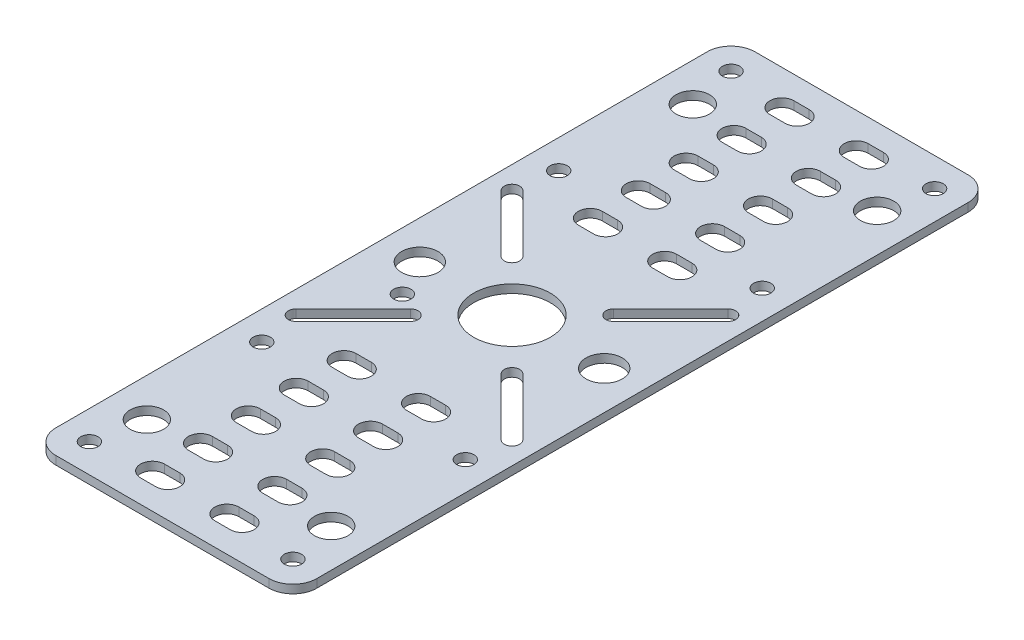
from build123d import *

# Parameters (mm, degrees)
SKETCH1_W            = 54.5
SKETCH1_H            = 146
BOSS_EXTRUDE1_DEPTH  = 1.75
SKETCH2_R            = 3.5
SKETCH2_R_2          = 3.795961701
SKETCH2_R_3          = 8
CUT_EXTRUDE1_DEPTH   = 78.939880677
M3_CLEARANCE_HOLE1_D = 3.6
FILLET1_R            = 5


with BuildPart() as part:
    # Sketch1 → Boss-Extrude1 (new body)
    with BuildSketch(Plane(origin=(0, 0, 0), x_dir=(1, 0, 0), z_dir=(0, 1, 0))):
        Rectangle(SKETCH1_W, SKETCH1_H)
    extrude(amount=BOSS_EXTRUDE1_DEPTH)

    # Sketch2 → Cut-Extrude1 (cut, through all)
    with BuildSketch(Plane(origin=(0, 1.75, 0), x_dir=(1, 0, 0), z_dir=(0, 1, 0))):
        with Locations(Location((-19.25, 57, 0), (0, 0, 270))):
            Circle(SKETCH2_R)
        with Locations(Location((-19.25, 0, 0), (0, 0, 270))):
            Circle(SKETCH2_R_2)
        with Locations(Location((-19.25, -57, 0), (0, 0, 90))):
            Circle(SKETCH2_R)
        with Locations(Location((19.25, -57, 0), (0, 0, 270))):
            Circle(SKETCH2_R)
        with Locations(Location((19.25, 0, 0), (0, 0, 90))):
            Circle(SKETCH2_R_2)
        with Locations(Location((19.25, 57, 0), (0, 0, 90))):
            Circle(SKETCH2_R)
        with Locations(Location((0, 0, 0), (0, 0, 270))):
            Circle(SKETCH2_R_3)
        with BuildLine():
            Line((-11.737972568, 9.475230868), (-23.68137085, 21.41862915))
            ThreePointArc((-23.68137085, 21.41862915), (-23.68137085, 23.68137085), (-21.41862915, 23.68137085))
            Line((-21.41862915, 23.68137085), (-9.475230868, 11.737972568))
            ThreePointArc((-9.475230868, 11.737972568), (-9.475230868, 9.475230868), (-11.737972568, 9.475230868))
        make_face()
        with BuildLine():
            Line((11.737972568, 9.475230868), (23.68137085, 21.41862915))
            ThreePointArc((23.68137085, 21.41862915), (23.68137085, 23.68137085), (21.41862915, 23.68137085))
            Line((21.41862915, 23.68137085), (9.475230868, 11.737972568))
            ThreePointArc((9.475230868, 11.737972568), (9.475230868, 9.475230868), (11.737972568, 9.475230868))
        make_face()
        with BuildLine():
            Line((-11.737972568, -9.475230868), (-23.68137085, -21.41862915))
            ThreePointArc((-23.68137085, -21.41862915), (-23.68137085, -23.68137085), (-21.41862915, -23.68137085))
            Line((-21.41862915, -23.68137085), (-9.475230868, -11.737972568))
            ThreePointArc((-9.475230868, -11.737972568), (-9.475230868, -9.475230868), (-11.737972568, -9.475230868))
        make_face()
        with BuildLine():
            Line((11.737972568, -9.475230868), (23.68137085, -21.41862915))
            ThreePointArc((23.68137085, -21.41862915), (23.68137085, -23.68137085), (21.41862915, -23.68137085))
            Line((21.41862915, -23.68137085), (9.475230868, -11.737972568))
            ThreePointArc((9.475230868, -11.737972568), (9.475230868, -9.475230868), (11.737972568, -9.475230868))
        make_face()
        with BuildLine():
            Line((-9.357792216, 68.20993346), (-6.161205405, 68.20993346))
            ThreePointArc((-6.161205405, 68.20993346), (-3.661205405, 65.70993346), (-6.161205405, 63.20993346))
            Line((-6.161205405, 63.20993346), (-9.357792216, 63.20993346))
            ThreePointArc((-9.357792216, 63.20993346), (-11.857792216, 65.70993346), (-9.357792216, 68.20993346))
        make_face()
        with BuildLine():
            Line((-9.357792216, 58.20993346), (-6.161205405, 58.20993346))
            ThreePointArc((-6.161205405, 58.20993346), (-3.661205405, 55.70993346), (-6.161205405, 53.20993346))
            Line((-6.161205405, 53.20993346), (-9.357792216, 53.20993346))
            ThreePointArc((-9.357792216, 53.20993346), (-11.857792216, 55.70993346), (-9.357792216, 58.20993346))
        make_face()
        with BuildLine():
            Line((9.357792216, 58.20993346), (6.161205405, 58.20993346))
            ThreePointArc((6.161205405, 58.20993346), (3.661205405, 55.70993346), (6.161205405, 53.20993346))
            Line((6.161205405, 53.20993346), (9.357792216, 53.20993346))
            ThreePointArc((9.357792216, 53.20993346), (11.857792216, 55.70993346), (9.357792216, 58.20993346))
        make_face()
        with BuildLine():
            Line((-9.357792216, 48.20993346), (-6.161205405, 48.20993346))
            ThreePointArc((-6.161205405, 48.20993346), (-3.661205405, 45.70993346), (-6.161205405, 43.20993346))
            Line((-6.161205405, 43.20993346), (-9.357792216, 43.20993346))
            ThreePointArc((-9.357792216, 43.20993346), (-11.857792216, 45.70993346), (-9.357792216, 48.20993346))
        make_face()
        with BuildLine():
            Line((9.357792216, 48.20993346), (6.161205405, 48.20993346))
            ThreePointArc((6.161205405, 48.20993346), (3.661205405, 45.70993346), (6.161205405, 43.20993346))
            Line((6.161205405, 43.20993346), (9.357792216, 43.20993346))
            ThreePointArc((9.357792216, 43.20993346), (11.857792216, 45.70993346), (9.357792216, 48.20993346))
        make_face()
        with BuildLine():
            Line((-9.357792216, 38.20993346), (-6.161205405, 38.20993346))
            ThreePointArc((-6.161205405, 38.20993346), (-3.661205405, 35.70993346), (-6.161205405, 33.20993346))
            Line((-6.161205405, 33.20993346), (-9.357792216, 33.20993346))
            ThreePointArc((-9.357792216, 33.20993346), (-11.857792216, 35.70993346), (-9.357792216, 38.20993346))
        make_face()
        with BuildLine():
            Line((9.357792216, 68.20993346), (6.161205405, 68.20993346))
            ThreePointArc((6.161205405, 68.20993346), (3.661205405, 65.70993346), (6.161205405, 63.20993346))
            Line((6.161205405, 63.20993346), (9.357792216, 63.20993346))
            ThreePointArc((9.357792216, 63.20993346), (11.857792216, 65.70993346), (9.357792216, 68.20993346))
        make_face()
        with BuildLine():
            Line((9.357792216, 38.20993346), (6.161205405, 38.20993346))
            ThreePointArc((6.161205405, 38.20993346), (3.661205405, 35.70993346), (6.161205405, 33.20993346))
            Line((6.161205405, 33.20993346), (9.357792216, 33.20993346))
            ThreePointArc((9.357792216, 33.20993346), (11.857792216, 35.70993346), (9.357792216, 38.20993346))
        make_face()
        with BuildLine():
            Line((-9.357792216, 28.20993346), (-6.161205405, 28.20993346))
            ThreePointArc((-6.161205405, 28.20993346), (-3.661205405, 25.70993346), (-6.161205405, 23.20993346))
            Line((-6.161205405, 23.20993346), (-9.357792216, 23.20993346))
            ThreePointArc((-9.357792216, 23.20993346), (-11.857792216, 25.70993346), (-9.357792216, 28.20993346))
        make_face()
        with BuildLine():
            Line((9.357792216, 28.20993346), (6.161205405, 28.20993346))
            ThreePointArc((6.161205405, 28.20993346), (3.661205405, 25.70993346), (6.161205405, 23.20993346))
            Line((6.161205405, 23.20993346), (9.357792216, 23.20993346))
            ThreePointArc((9.357792216, 23.20993346), (11.857792216, 25.70993346), (9.357792216, 28.20993346))
        make_face()
        with BuildLine():
            Line((-9.357792216, -68.20993346), (-6.161205405, -68.20993346))
            ThreePointArc((-6.161205405, -68.20993346), (-3.661205405, -65.70993346), (-6.161205405, -63.20993346))
            Line((-6.161205405, -63.20993346), (-9.357792216, -63.20993346))
            ThreePointArc((-9.357792216, -63.20993346), (-11.857792216, -65.70993346), (-9.357792216, -68.20993346))
        make_face()
        with BuildLine():
            Line((-9.357792216, -58.20993346), (-6.161205405, -58.20993346))
            ThreePointArc((-6.161205405, -58.20993346), (-3.661205405, -55.70993346), (-6.161205405, -53.20993346))
            Line((-6.161205405, -53.20993346), (-9.357792216, -53.20993346))
            ThreePointArc((-9.357792216, -53.20993346), (-11.857792216, -55.70993346), (-9.357792216, -58.20993346))
        make_face()
        with BuildLine():
            Line((9.357792216, -58.20993346), (6.161205405, -58.20993346))
            ThreePointArc((6.161205405, -58.20993346), (3.661205405, -55.70993346), (6.161205405, -53.20993346))
            Line((6.161205405, -53.20993346), (9.357792216, -53.20993346))
            ThreePointArc((9.357792216, -53.20993346), (11.857792216, -55.70993346), (9.357792216, -58.20993346))
        make_face()
        with BuildLine():
            Line((-9.357792216, -48.20993346), (-6.161205405, -48.20993346))
            ThreePointArc((-6.161205405, -48.20993346), (-3.661205405, -45.70993346), (-6.161205405, -43.20993346))
            Line((-6.161205405, -43.20993346), (-9.357792216, -43.20993346))
            ThreePointArc((-9.357792216, -43.20993346), (-11.857792216, -45.70993346), (-9.357792216, -48.20993346))
        make_face()
        with BuildLine():
            Line((9.357792216, -48.20993346), (6.161205405, -48.20993346))
            ThreePointArc((6.161205405, -48.20993346), (3.661205405, -45.70993346), (6.161205405, -43.20993346))
            Line((6.161205405, -43.20993346), (9.357792216, -43.20993346))
            ThreePointArc((9.357792216, -43.20993346), (11.857792216, -45.70993346), (9.357792216, -48.20993346))
        make_face()
        with BuildLine():
            Line((-9.357792216, -38.20993346), (-6.161205405, -38.20993346))
            ThreePointArc((-6.161205405, -38.20993346), (-3.661205405, -35.70993346), (-6.161205405, -33.20993346))
            Line((-6.161205405, -33.20993346), (-9.357792216, -33.20993346))
            ThreePointArc((-9.357792216, -33.20993346), (-11.857792216, -35.70993346), (-9.357792216, -38.20993346))
        make_face()
        with BuildLine():
            Line((9.357792216, -68.20993346), (6.161205405, -68.20993346))
            ThreePointArc((6.161205405, -68.20993346), (3.661205405, -65.70993346), (6.161205405, -63.20993346))
            Line((6.161205405, -63.20993346), (9.357792216, -63.20993346))
            ThreePointArc((9.357792216, -63.20993346), (11.857792216, -65.70993346), (9.357792216, -68.20993346))
        make_face()
        with BuildLine():
            Line((9.357792216, -38.20993346), (6.161205405, -38.20993346))
            ThreePointArc((6.161205405, -38.20993346), (3.661205405, -35.70993346), (6.161205405, -33.20993346))
            Line((6.161205405, -33.20993346), (9.357792216, -33.20993346))
            ThreePointArc((9.357792216, -33.20993346), (11.857792216, -35.70993346), (9.357792216, -38.20993346))
        make_face()
        with BuildLine():
            Line((-9.357792216, -28.20993346), (-6.161205405, -28.20993346))
            ThreePointArc((-6.161205405, -28.20993346), (-3.661205405, -25.70993346), (-6.161205405, -23.20993346))
            Line((-6.161205405, -23.20993346), (-9.357792216, -23.20993346))
            ThreePointArc((-9.357792216, -23.20993346), (-11.857792216, -25.70993346), (-9.357792216, -28.20993346))
        make_face()
        with BuildLine():
            Line((9.357792216, -28.20993346), (6.161205405, -28.20993346))
            ThreePointArc((6.161205405, -28.20993346), (3.661205405, -25.70993346), (6.161205405, -23.20993346))
            Line((6.161205405, -23.20993346), (9.357792216, -23.20993346))
            ThreePointArc((9.357792216, -23.20993346), (11.857792216, -25.70993346), (9.357792216, -28.20993346))
        make_face()
    extrude(amount=-CUT_EXTRUDE1_DEPTH, mode=Mode.SUBTRACT)

    # M3 Clearance Hole1 (through all)
    with Locations(Plane(origin=(0, 1.75, 0), x_dir=(1, 0, 0), z_dir=(0, 1, 0))):
        with Locations((-21.25, 67), (21.25, -67), (-21.25, -67), (-21.25, 31), (21.25, 67), (21.25, 31), (21.25, -31), (-21.25, -31), (-15.25, -7.65)):
            Hole(M3_CLEARANCE_HOLE1_D / 2)

    # Fillet1
    fillet1_edges = [part.edges().sort_by_distance(p)[0] for p in [
        (27.25, 0.875, 73),
        (-27.25, 0.875, 73),
        (-27.25, 0.875, -73),
        (27.25, 0.875, -73),
    ]]
    fillet(fillet1_edges, radius=FILLET1_R)


solid = part.part
